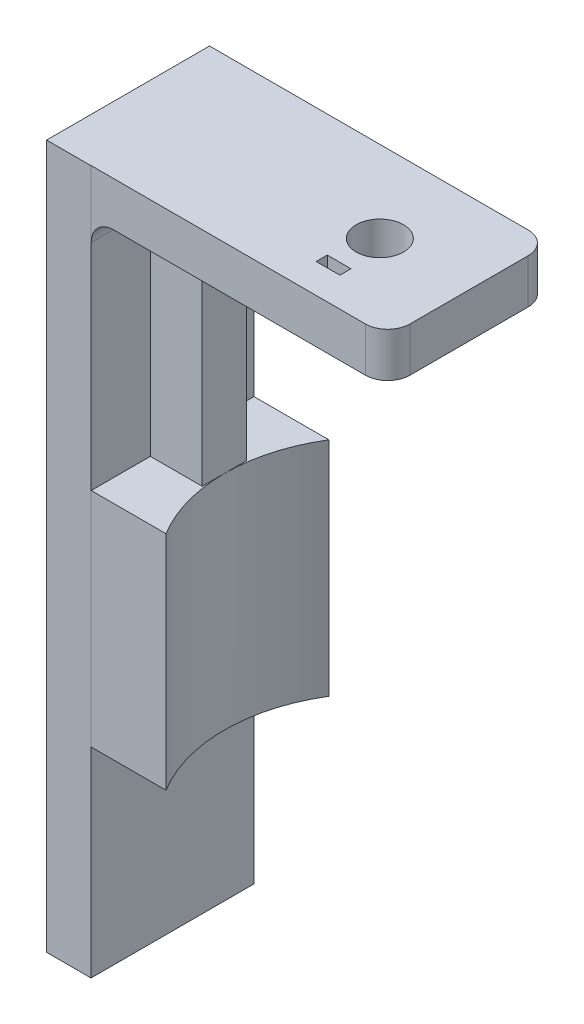
from build123d import *

# Parameters (mm, degrees)
SKETCH2_W           = 6
SKETCH2_H           = 22
BOSS_EXTRUDE2_DEPTH = 95
SKETCH3_R           = 3.2
SKETCH3_W           = 3.2
SKETCH3_H           = 1.5
BOSS_EXTRUDE3_DEPTH = 6
SKETCH4_W           = 6
SKETCH4_H           = 62
BOSS_EXTRUDE4_DEPTH = 7
BOSS_EXTRUDE5_DEPTH = 30
FILLET4_R           = 3


with BuildPart() as part:
    # Sketch2 → Boss-Extrude2 (new body)
    with BuildSketch(Plane(origin=(0, 0, 0), x_dir=(1, 0, 0), z_dir=(0, 1, 0))):
        with Locations((-31, 0)):
            Rectangle(SKETCH2_W, SKETCH2_H)
    extrude(amount=BOSS_EXTRUDE2_DEPTH)

    # Sketch3 → Boss-Extrude3 (add)
    with BuildSketch(Plane(origin=(0, 95, 0), x_dir=(1, 0, 0), z_dir=(0, 1, 0))):
        with BuildLine():
            Line((-28, 11), (9.041317524, 11))
            ThreePointArc((9.041317524, 11), (11.162637868, 10.121320344), (12.041317524, 8))
            Line((12.041317524, 8), (12.041317524, -7.97837003))
            ThreePointArc((12.041317524, -7.97837003), (11.162637868, -10.099690374), (9.041317524, -10.97837003))
            Line((9.041317524, -10.97837003), (-28, -10.97837003))
            Line((-28, -10.97837003), (-28, 11))
        make_face()
        with Locations(Location((0, 0, 0), (0, 0, 270))):
            Circle(SKETCH3_R, mode=Mode.SUBTRACT)
        with Locations((0, -6.25)):
            Rectangle(SKETCH3_W, SKETCH3_H, mode=Mode.SUBTRACT)
    extrude(amount=-BOSS_EXTRUDE3_DEPTH)

    # Sketch4 → Boss-Extrude4 (add)
    with BuildSketch(Plane(origin=(-28, 0, 0), x_dir=(0, 0, -1), z_dir=(1, 0, 0))):
        with Locations((0.010814985, 58)):
            Rectangle(SKETCH4_W, SKETCH4_H)
    extrude(amount=BOSS_EXTRUDE4_DEPTH)

    # Sketch5 → Boss-Extrude5 (add)
    with BuildSketch(Plane.XZ.offset(-27)):
        with BuildLine():
            Line((-28, 10.97837003), (-17.901826484, 10.97837003))
            ThreePointArc((-17.901826484, 10.97837003), (-20.999996165, -0.012691382), (-17.88854382, -11))
            Line((-17.88854382, -11), (-28, -11))
            Line((-28, -11), (-28, 10.97837003))
        make_face()
    extrude(amount=-BOSS_EXTRUDE5_DEPTH)

    # Fillet4
    fillet4_edges = [part.edges().sort_by_distance(p)[0] for p in [
        (-28, 89, -7.005407492),
        (-28, 89, 6.983777523),
        (-21, 89, -0.010814985),
    ]]
    fillet(fillet4_edges, radius=FILLET4_R)


solid = part.part
